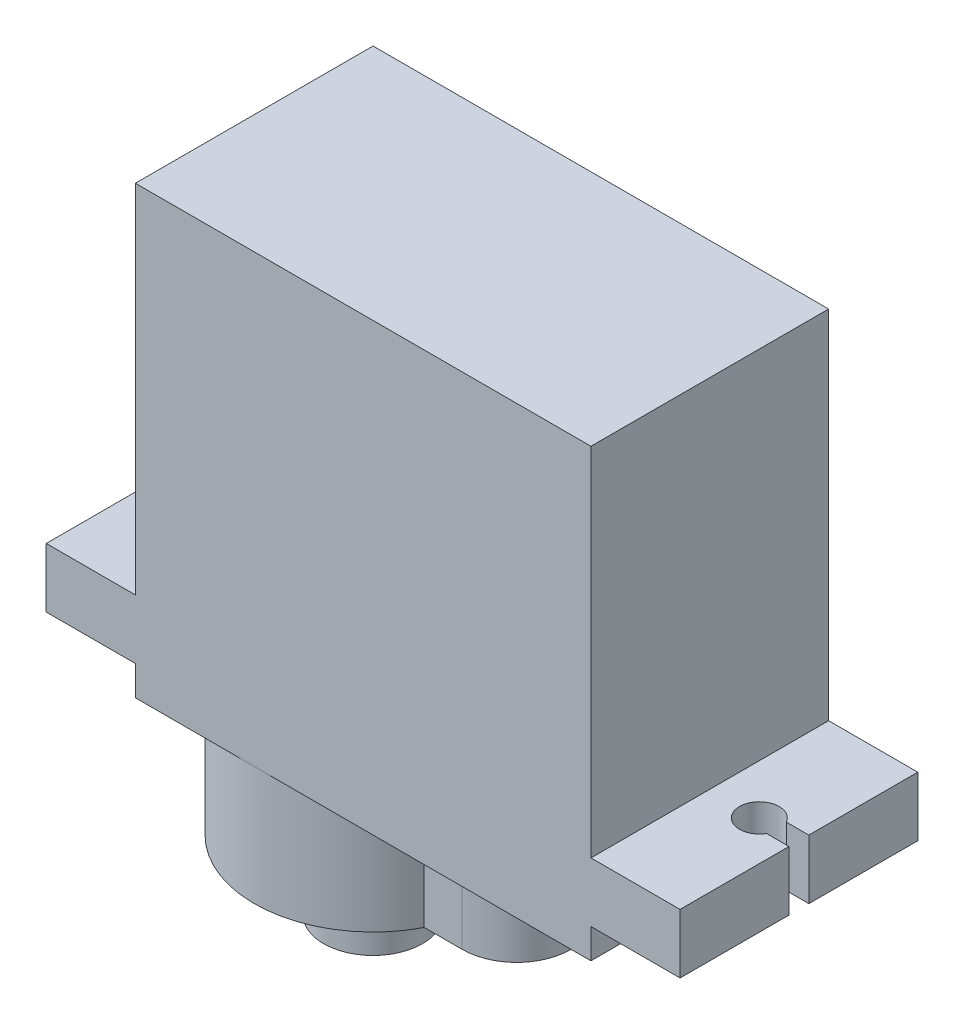
from build123d import *

# Parameters (mm, degrees)
SKETCH_1_W          = 23
SKETCH_1_H          = 12
EXTRUDE_1_DEPTH     = 22.5
SKETCH_3_W          = 32
SKETCH_3_H          = 12
EXTRUDE_2_DEPTH     = 3
CUT_EXTRUDE_1_DEPTH = 3
SKETCH_5_R          = 6
EXTRUDE_3_DEPTH     = 6
SKETCH_6_R          = 2.5
EXTRUDE_4_DEPTH     = 3.5
EXTRUDE_5_DEPTH     = 6
SKETCH_8_W          = 3
SKETCH_8_H          = 0.8
EXTRUDE_6_DEPTH     = 1


with BuildPart() as part:
    # 草图1 → 凸台-拉伸1 (new body)
    with BuildSketch(Plane(origin=(0, 0, 0), x_dir=(1, 0, 0), z_dir=(0, 1, 0))):
        Rectangle(SKETCH_1_W, SKETCH_1_H)
    extrude(amount=EXTRUDE_1_DEPTH)

    # 草图3 → 凸台-拉伸2 (add)
    with BuildSketch(Plane(origin=(0, 4.5, 0), x_dir=(1, 0, 0), z_dir=(0, 1, 0))):
        Rectangle(SKETCH_3_W, SKETCH_3_H)
    extrude(amount=-EXTRUDE_2_DEPTH)

    # 草图4 → 切除-拉伸1 (cut)
    with BuildSketch(Plane.XZ.offset(-1.5)):
        with BuildLine():
            Line((-16.941045567, 0.5), (-14.866025404, 0.5))
            ThreePointArc((-14.866025404, 0.5), (-13, 0), (-14.866025404, -0.5))
            Line((-14.866025404, -0.5), (-16.941045567, -0.5))
            Line((-16.941045567, -0.5), (-16.941045567, 0.5))
        make_face()
        with BuildLine():
            Line((16.941045567, 0.5), (16.941045567, -0.5))
            Line((16.941045567, -0.5), (14.866025404, -0.5))
            ThreePointArc((14.866025404, -0.5), (13, 0), (14.866025404, 0.5))
            Line((14.866025404, 0.5), (16.941045567, 0.5))
        make_face()
    extrude(amount=-CUT_EXTRUDE_1_DEPTH, mode=Mode.SUBTRACT)

    # 草图5 → 凸台-拉伸3 (add)
    with BuildSketch(Plane.XZ):
        with Locations(Location((-5.5, 0, 0), (0, 0, 270))):
            Circle(SKETCH_5_R)
    extrude(amount=EXTRUDE_3_DEPTH)

    # 草图6 → 凸台-拉伸4 (add)
    with BuildSketch(Plane.XZ.offset(6)):
        with Locations(Location((-5.5, 0, 0), (0, 0, 270))):
            Circle(SKETCH_6_R)
    extrude(amount=EXTRUDE_4_DEPTH)

    # 草图7 → 凸台-拉伸5 (add)
    with BuildSketch(Plane(origin=(0, 0, 0), x_dir=(1, 0, 0), z_dir=(0, 1, 0))):
        with BuildLine():
            Line((1.75, -2.75), (-1.67047712, -2.75))
            Line((-1.67047712, -2.75), (-1.67047712, 2.75))
            Line((-1.67047712, 2.75), (1.75, 2.75))
            ThreePointArc((1.75, 2.75), (4.5, 0), (1.75, -2.75))
        make_face()
    extrude(amount=-EXTRUDE_5_DEPTH)

    # 草图8 → 凸台-拉伸6 (add)
    with BuildSketch(Plane.ZY.offset(11.5)):
        with Locations((0, 17.9)):
            Rectangle(SKETCH_8_W, SKETCH_8_H)
    extrude(amount=EXTRUDE_6_DEPTH)


solid = part.part
